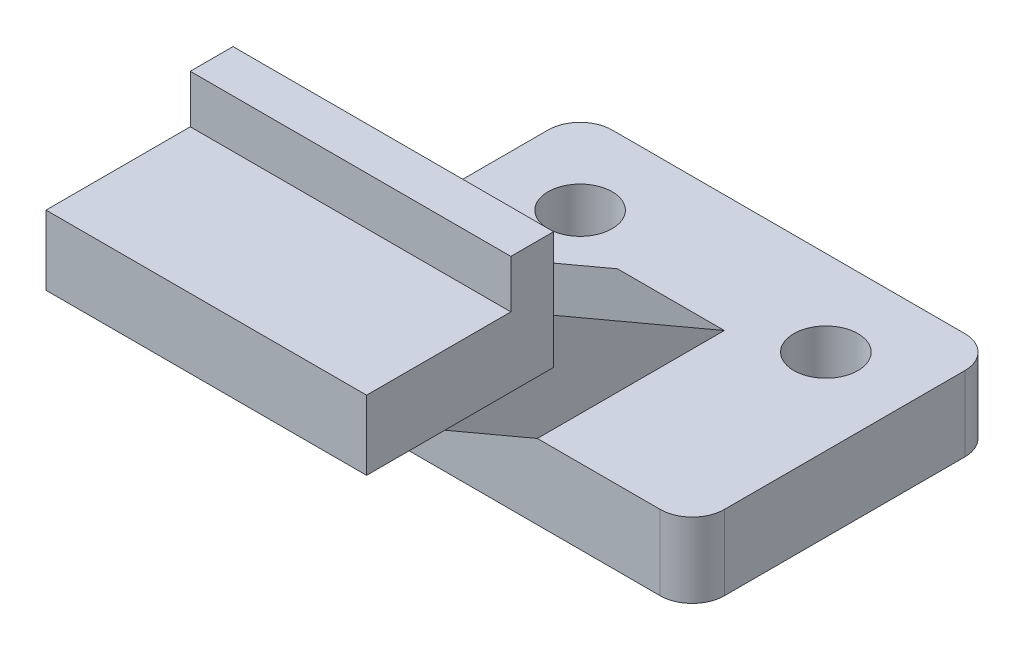
from build123d import *

# Parameters (mm, degrees)
ESTRUSIONE_ESTRUSIONE1_DEPTH = 78
TAGLIO_ESTRUSIONE1_DEPTH     = 29
TAGLIO_ESTRUSIONE2_DEPTH     = 29
SCHIZZO4_W                   = 35
SCHIZZO4_H                   = 22
TAGLIO_ESTRUSIONE3_DEPTH     = 9
SCHIZZO5_W                   = 35
SCHIZZO5_H                   = 22
TAGLIO_ESTRUSIONE4_DEPTH     = 9
SCHIZZO6_R                   = 6
TAGLIO_ESTRUSIONE5_DEPTH     = 144.738003889
RACCORDO1_R                  = 6


with BuildPart() as part:
    # Schizzo1 → Estrusione-Estrusione1 (new body)
    with BuildSketch(Plane(origin=(0, 0, 0), x_dir=(0, 0, -1), z_dir=(1, 0, 0))):
        Polygon((-57, 0), (0, 0), (0, 14), (-22, 14), (-73.961524227, 44), (-73.961524227, 66), (-81.961524227, 66), (-81.961524227, 57), (-108.961524227, 57), (-108.961524227, 44), (-57, 14), align=None)
    extrude(amount=-ESTRUSIONE_ESTRUSIONE1_DEPTH)

    # Schizzo2 → Taglio-Estrusione1 (cut)
    with BuildSketch(Plane(origin=(0, 0, 0), x_dir=(0, 0, -1), z_dir=(1, 0, 0))):
        Polygon((-22, 14), (-57, 14), (-108.961524227, 44), (-73.961524227, 44), align=None)
    extrude(amount=-TAGLIO_ESTRUSIONE1_DEPTH, mode=Mode.SUBTRACT)

    # Schizzo3 → Taglio-Estrusione2 (cut)
    with BuildSketch(Plane.ZY.offset(78)):
        Polygon((57, 14), (22, 14), (73.961524227, 44), (108.961524227, 44), align=None)
    extrude(amount=-TAGLIO_ESTRUSIONE2_DEPTH, mode=Mode.SUBTRACT)

    # Schizzo4 → Taglio-Estrusione3 (cut)
    with BuildSketch(Plane.ZY.offset(78)):
        with Locations((91.461524227, 55)):
            Rectangle(SCHIZZO4_W, SCHIZZO4_H)
    extrude(amount=-TAGLIO_ESTRUSIONE3_DEPTH, mode=Mode.SUBTRACT)

    # Schizzo5 → Taglio-Estrusione4 (cut)
    with BuildSketch(Plane(origin=(0, 0, 0), x_dir=(0, 0, -1), z_dir=(1, 0, 0))):
        with Locations((-91.461524227, 55)):
            Rectangle(SCHIZZO5_W, SCHIZZO5_H)
    extrude(amount=-TAGLIO_ESTRUSIONE4_DEPTH, mode=Mode.SUBTRACT)

    # Schizzo6 → Taglio-Estrusione5 (cut, through all)
    with BuildSketch(Plane(origin=(0, 14, 0), x_dir=(1, 0, 0), z_dir=(0, 1, 0))):
        with Locations(Location((-16, -16, 0), (0, 0, 270))):
            Circle(SCHIZZO6_R)
        with Locations(Location((-62, -16, 0), (0, 0, 270))):
            Circle(SCHIZZO6_R)
    extrude(amount=-TAGLIO_ESTRUSIONE5_DEPTH, mode=Mode.SUBTRACT)

    # Raccordo1
    raccordo1_edges = [part.edges().sort_by_distance(p)[0] for p in [
        (0, 7, 0),
        (0, 7, 57),
        (-78, 7, 57),
        (-78, 7, 0),
    ]]
    fillet(raccordo1_edges, radius=RACCORDO1_R)


solid = part.part
